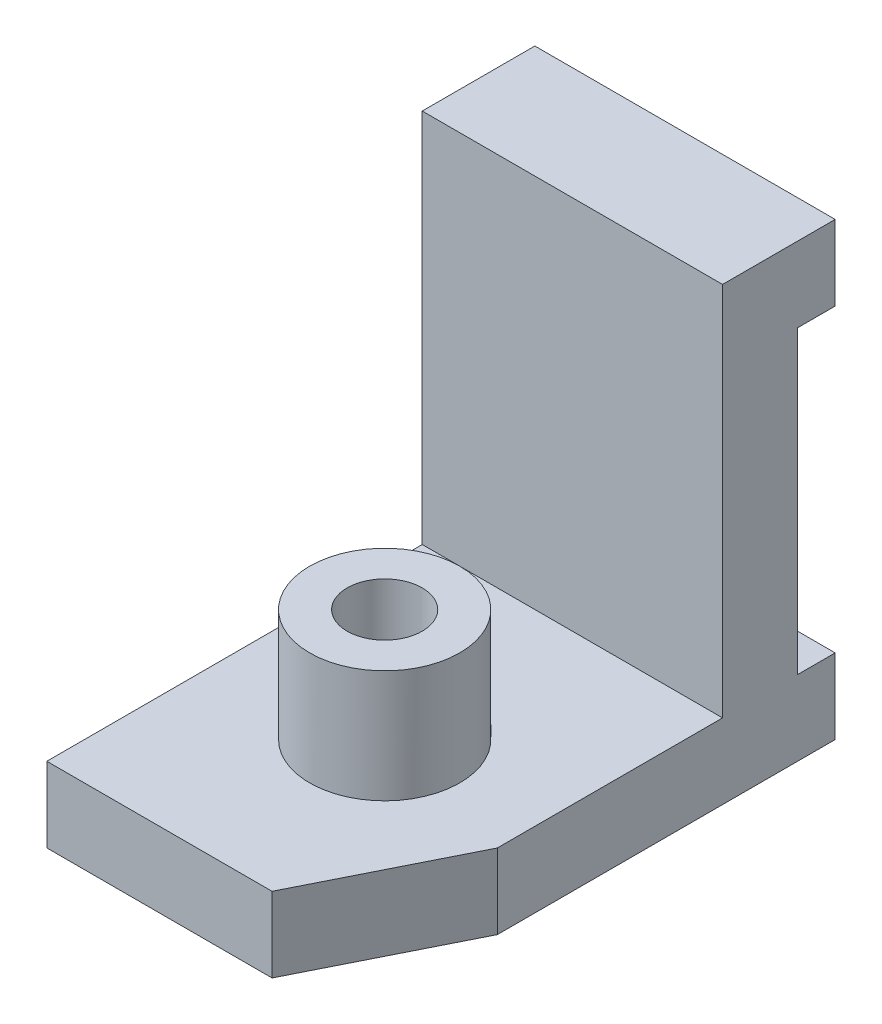
from build123d import *

# Parameters (mm, degrees)
BOSS_EXTRUDE1_DEPTH = 40
CHAMFER2_SIZE       = 10
CHAMFER2_SIZE2      = 20
SKETCH2_R           = 10
SKETCH2_R_2         = 5
BOSS_EXTRUDE2_DEPTH = 15


with BuildPart() as part:
    # Sketch1 → Boss-Extrude1 (new body)
    with BuildSketch(Plane.YZ):
        Polygon((0, 0), (10, 0), (10, 5), (50, 5), (50, 0), (60, 0), (60, 15), (10, 15), (10, 65), (0, 65), align=None)
    extrude(amount=BOSS_EXTRUDE1_DEPTH)

    # Chamfer2
    chamfer2_edges = [part.edges().sort_by_distance(p)[0] for p in [
        (40, 5, 65),
    ]]
    chamfer2_side = [part.faces().sort_by_distance(p)[0] for p in [
        (20, 5, 65),
    ]]
    chamfer(chamfer2_edges, length=CHAMFER2_SIZE, length2=CHAMFER2_SIZE2, reference=chamfer2_side[0])

    # Sketch2 → Boss-Extrude2 (add)
    with BuildSketch(Plane(origin=(0, 10, 0), x_dir=(-1, 0, 0), z_dir=(0, 1, 0))):
        with Locations(Location((-20, 40, 0), (0, 0, 270))):
            Circle(SKETCH2_R)
        with Locations(Location((-20, 40, 0), (0, 0, 90))):
            Circle(SKETCH2_R_2, mode=Mode.SUBTRACT)
    extrude(amount=BOSS_EXTRUDE2_DEPTH)


solid = part.part
